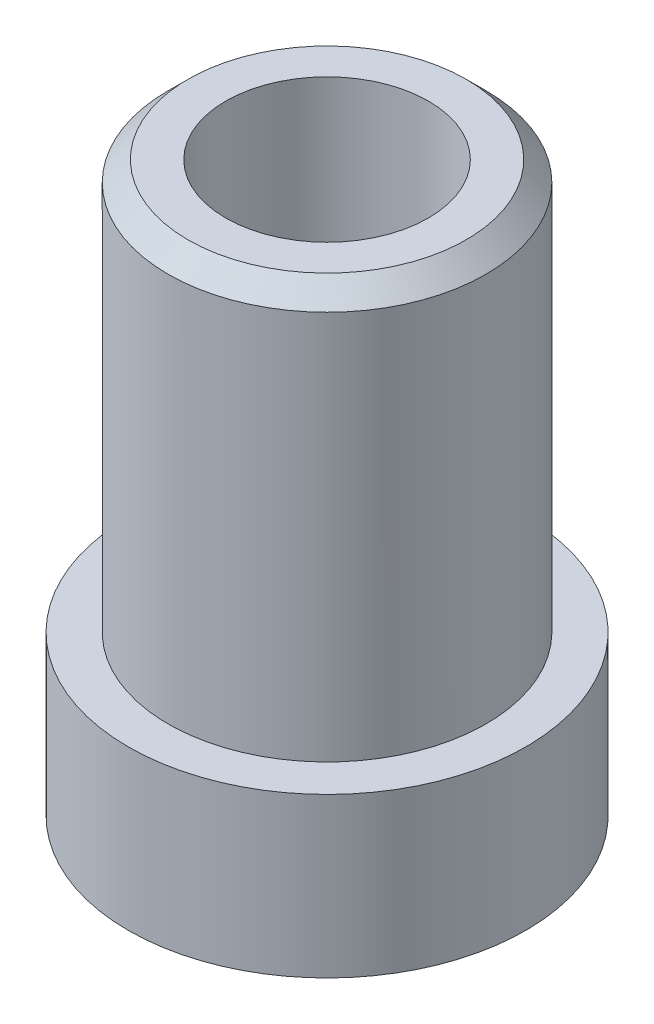
from build123d import *

# Parameters (mm, degrees)
SKETCH_1_R              = 4
EXTRUDE_1_DEPTH         = 7.15
SKETCH_2_W              = 1
SKETCH_2_H              = 4
CHAMFER_1_SIZE          = 0.5
HOLE_WIZARD_5_1_5_1_1_D = 5.1


with BuildPart() as part:
    # 草图1 → 凸台-拉伸1 (new, symmetric)
    with BuildSketch(Plane(origin=(0, 0, 0), x_dir=(1, 0, 0), z_dir=(0, 1, 0))):
        with Locations(Location((0, 0, 0), (0, 0, 270))):
            Circle(SKETCH_1_R)
    extrude(amount=EXTRUDE_1_DEPTH, both=True)

    # 草图2 → 旋转1 (revolve)
    with BuildSketch(Plane.XY, mode=Mode.PRIVATE) as revolve_1_sk:
        with Locations((4.5, -5.15)):
            Rectangle(SKETCH_2_W, SKETCH_2_H)
    revolve(revolve_1_sk.sketch.rotate(Axis((0, 7.15, 0), (0, -1, 0)), 270), axis=Axis((0, 7.15, 0), (0, -1, 0)))

    # 倒角1
    chamfer_1_edges = [part.edges().sort_by_distance(p)[0] for p in [
        (0, 7.15, -4),
    ]]
    chamfer(chamfer_1_edges, length=CHAMFER_1_SIZE)

    # Ø5.1 (5.1) 直径孔1 (through all)
    with Locations(Plane(origin=(0, -7.15, 0), x_dir=(-1, 0, 0), z_dir=(0, -1, 0))):
        with Locations((0, 0)):
            Hole(HOLE_WIZARD_5_1_5_1_1_D / 2)


solid = part.part
